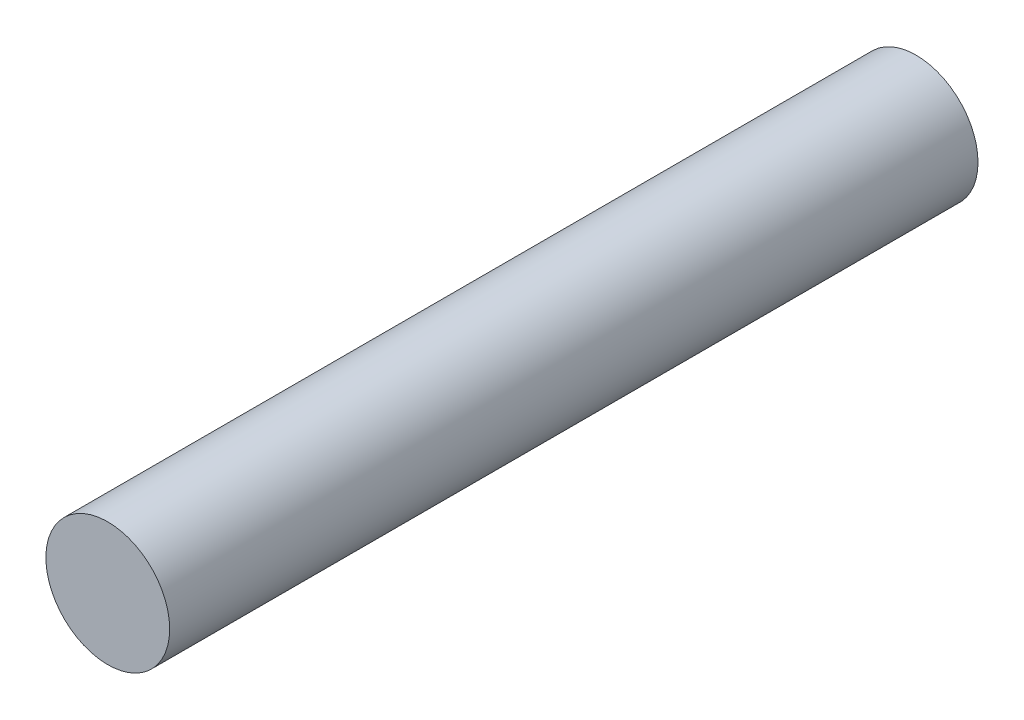
from build123d import *

# Parameters (mm, degrees)
SKETCH1_R           = 10.7200241
BOSS_EXTRUDE1_DEPTH = 140


with BuildPart() as part:
    # Sketch1 → Boss-Extrude1 (new body)
    with BuildSketch(Plane.XY):
        Circle(SKETCH1_R)
    extrude(amount=BOSS_EXTRUDE1_DEPTH)


solid = part.part
